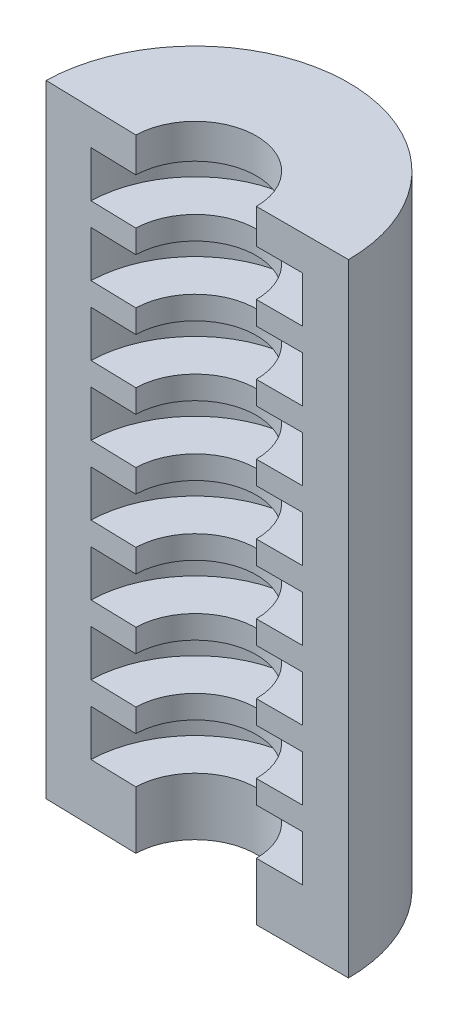
from build123d import *

# Parameters (mm, degrees)
REVOLVE1_ANGLE = 178.5


with BuildPart() as part:
    # Sketch1 → Revolve1 (revolve)
    with BuildSketch(Plane.XY):
        Polygon((5.3, 21.274776409), (5.3, 24.274776409), (13.3, 24.274776409), (13.3, -29.725223591), (5.3, -29.725223591), (5.3, -26.725223591), (5.3, -24.725223591), (9.3, -24.725223591), (9.3, -20.725223591), (5.3, -20.725223591), (5.3, -18.725223591), (9.3, -18.725223591), (9.3, -14.725223591), (5.3, -14.725223591), (5.3, -12.725223591), (9.3, -12.725223591), (9.3, -8.725223591), (5.3, -8.725223591), (5.3, -6.725223591), (9.3, -6.725223591), (9.3, -2.725223591), (5.3, -2.725223591), (5.3, -0.725223591), (9.3, -0.725223591), (9.3, 3.274776409), (5.3, 3.274776409), (5.3, 5.274776409), (9.3, 5.274776409), (9.3, 9.274776409), (5.3, 9.274776409), (5.3, 11.274776409), (9.3, 11.274776409), (9.3, 15.274776409), (5.3, 15.274776409), (5.3, 17.274776409), (9.3, 17.274776409), (9.3, 21.274776409), align=None)
    revolve(axis=Axis((0, -24, 0), (0, 1, 0)), revolution_arc=REVOLVE1_ANGLE)


solid = part.part
